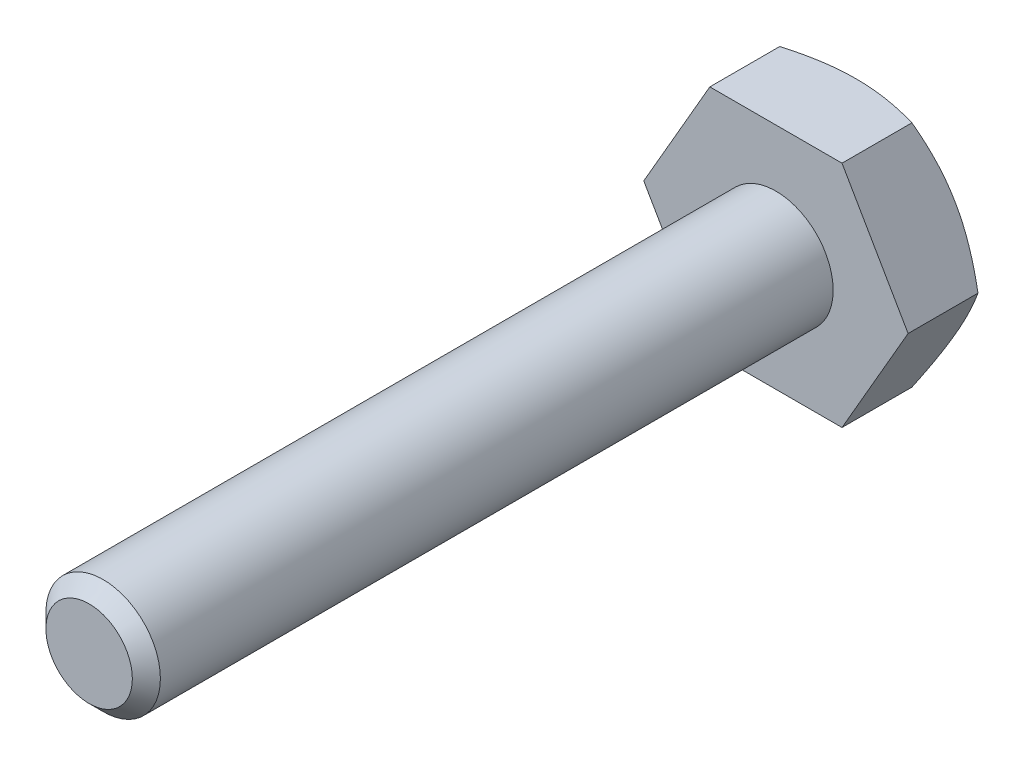
from build123d import *

# Parameters (mm, degrees)
EXTRUDE1_DEPTH = 1.4
SKETCH2_R      = 1
EXTRUDE2_DEPTH = 12
CHAMFER1_SIZE  = 0.245


with BuildPart() as part:
    # Sketch1 → Extrude1 (new body)
    with BuildSketch(Plane.XY):
        Polygon((2.309401077, 0), (1.154700538, 2), (-1.154700538, 2), (-2.309401077, 0), (-1.154700538, -2), (1.154700538, -2), align=None)
    extrude(amount=EXTRUDE1_DEPTH)

    # Sketch2 → Extrude2 (add)
    with BuildSketch(Plane.XY.offset(1.4)):
        Circle(SKETCH2_R)
    extrude(amount=EXTRUDE2_DEPTH)

    # Sketch3 → Cut-Revolve1 (revolve, cut)
    with BuildSketch(Plane(origin=(0, 0, 0), x_dir=(0, 0, -1), z_dir=(1, 0, 0))):
        Polygon((0, 2), (0, 102), (-57.735026919, 102), align=None)
    revolve(axis=Axis((0, 0, 0), (0, 0, -1)), mode=Mode.SUBTRACT)

    # Chamfer1
    chamfer1_edges = [part.edges().sort_by_distance(p)[0] for p in [
        (-1, 0, 13.4),
    ]]
    chamfer(chamfer1_edges, length=CHAMFER1_SIZE)


solid = part.part
